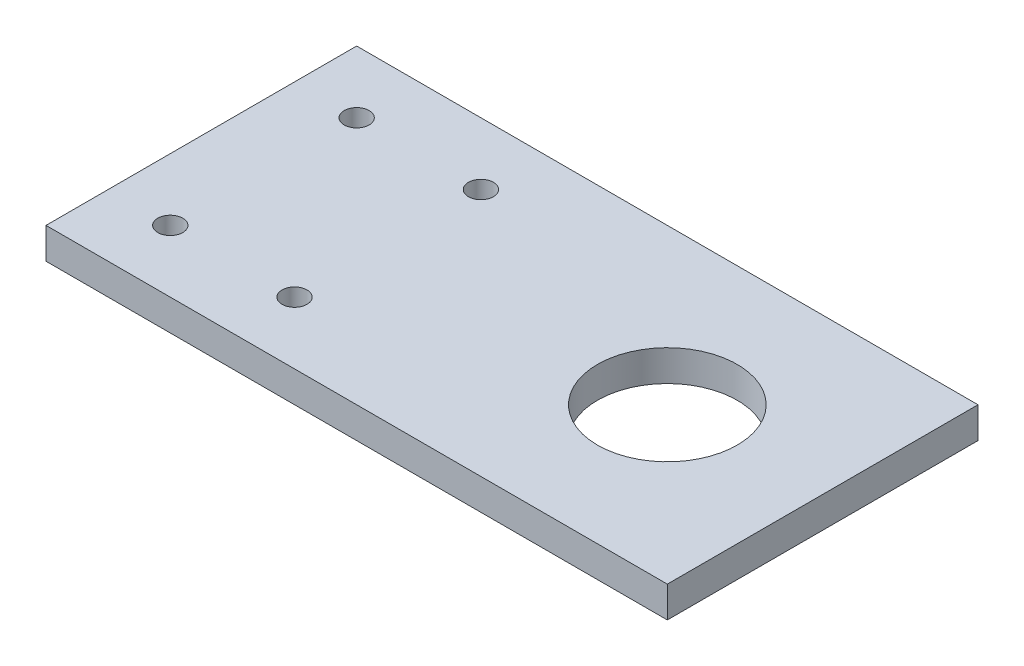
from build123d import *

# Parameters (mm, degrees)
BOSS_EXTRUDE1_DEPTH    = 6.35
F_10_CLEARANCE_HOLE1_D = 5.1054
SKETCH5_R              = 14.2875
CUT_EXTRUDE1_DEPTH     = 83.793870546


with BuildPart() as part:
    # Sketch1 → Boss-Extrude1 (new body)
    with BuildSketch(Plane(origin=(0, 0, 0), x_dir=(1, 0, 0), z_dir=(0, 1, 0))):
        Polygon((50.8, 31.75), (76.2, 31.75), (76.2, -31.75), (50.8, -31.75), (-50.8, -31.75), (-50.8, 31.75), align=None)
    extrude(amount=BOSS_EXTRUDE1_DEPTH)

    # #10 Clearance Hole1 (through all)
    with Locations(Plane(origin=(0, 6.35, 0), x_dir=(1, 0, 0), z_dir=(0, 1, 0))):
        with Locations((-38.1, 19.05), (-12.7, 19.05), (-12.7, -19.05), (-38.1, -19.05)):
            Hole(F_10_CLEARANCE_HOLE1_D / 2)

    # Sketch5 → Cut-Extrude1 (cut, through all)
    with BuildSketch(Plane(origin=(0, 6.35, 0), x_dir=(1, 0, 0), z_dir=(0, 1, 0))):
        with Locations(Location((44.45, 0, 0), (0, 0, 270))):
            Circle(SKETCH5_R)
    extrude(amount=-CUT_EXTRUDE1_DEPTH, mode=Mode.SUBTRACT)


solid = part.part
